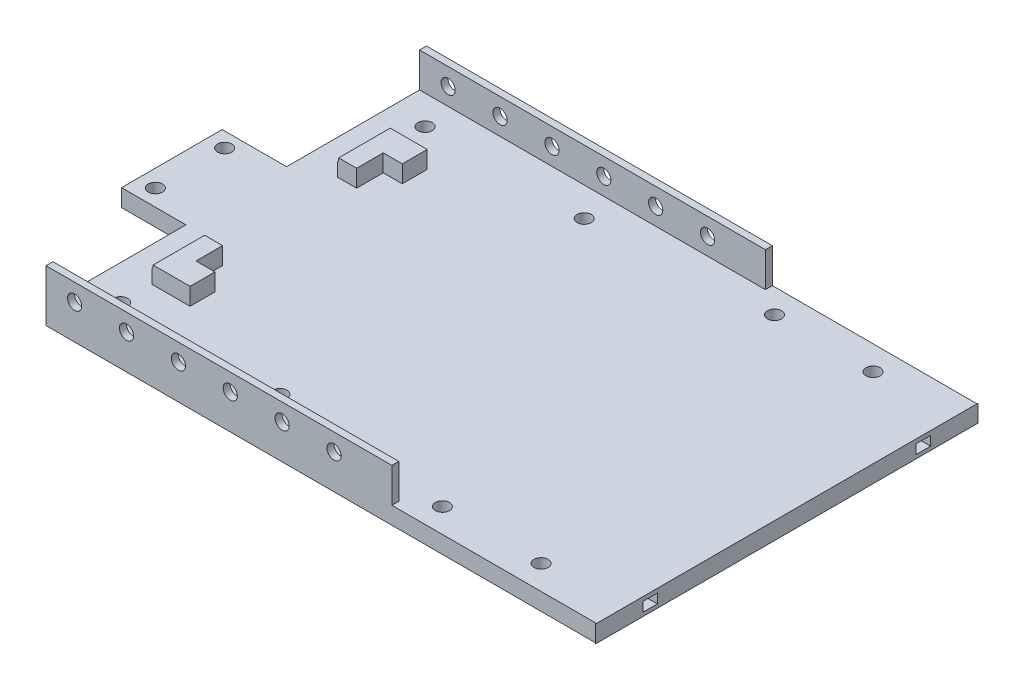
from build123d import *

# Parameters (mm, degrees)
SKETCH1_W           = 67
SKETCH1_H           = 155
SKETCH1_W_2         = 160
SKETCH1_H_2         = 110
SKETCH1_W_3         = 18.62
SKETCH1_H_3         = 29.1
BOSS_EXTRUDE1_DEPTH = 5
SKETCH4_W           = 100
SKETCH4_H           = 2
BOSS_EXTRUDE2_DEPTH = 10
SKETCH9_W           = 0.845761127
SKETCH9_H           = 22.5
BOSS_EXTRUDE4_DEPTH = 5
BOSS_EXTRUDE3_DEPTH = 5
SKETCH7_R           = 2.05
CUT_EXTRUDE2_DEPTH  = 10
SKETCH6_R           = 2.05
CUT_EXTRUDE1_DEPTH  = 227.055622359
SKETCH10_R          = 2.05
CUT_EXTRUDE4_DEPTH  = 10
FILLET1_R           = 0.3
SKETCH16_R          = 2.05
CUT_EXTRUDE5_DEPTH  = 251.551680098
SKETCH18_W          = 4
SKETCH18_H          = 2.5
BOSS_EXTRUDE7_DEPTH = 7
SKETCH20_W          = 4.2
SKETCH20_H          = 2.7
SKETCH20_W_2        = 4
SKETCH20_H_2        = 2.5
CUT_EXTRUDE7_DEPTH  = 8
SKETCH21_W          = 4
SKETCH21_H          = 2.5
CUT_EXTRUDE8_DEPTH  = 1


with BuildPart() as part:
    # Sketch1 → Boss-Extrude1 (new body)
    with BuildSketch(Plane(origin=(0, 0, 0), x_dir=(1, 0, 0), z_dir=(0, 1, 0))):
        Rectangle(SKETCH1_W, SKETCH1_H)
        with Locations((-113.5, 0)):
            Rectangle(SKETCH1_W_2, SKETCH1_H_2)
        with Locations((-202.81, 0)):
            Rectangle(SKETCH1_W_3, SKETCH1_H_3)
    extrude(amount=BOSS_EXTRUDE1_DEPTH)

    # Sketch4 → Boss-Extrude2 (add)
    with BuildSketch(Plane(origin=(0, 5, 0), x_dir=(1, 0, 0), z_dir=(0, 1, 0))):
        with Locations((-143.5, -54)):
            Rectangle(SKETCH4_W, SKETCH4_H)
        with Locations((-143.5, 54)):
            Rectangle(SKETCH4_W, SKETCH4_H)
    extrude(amount=BOSS_EXTRUDE2_DEPTH)

    # Sketch9 → Boss-Extrude4 (add)
    with BuildSketch(Plane(origin=(0, 5, 0), x_dir=(1, 0, 0), z_dir=(0, 1, 0))):
        with Locations((-33.922880564, -66.25)):
            Rectangle(SKETCH9_W, SKETCH9_H)
        with Locations((-33.922880564, 66.25)):
            Rectangle(SKETCH9_W, SKETCH9_H)
    extrude(amount=-BOSS_EXTRUDE4_DEPTH)

    # Sketch5 → Boss-Extrude3 (add)
    with BuildSketch(Plane(origin=(0, 5, 0), x_dir=(1, 0, 0), z_dir=(0, 1, 0))):
        Polygon((-178, 27), (-172.5, 27), (-172.5, 34.2), (-183.5, 34.2), (-183.5, 19.3), (-178, 19.3), align=None)
        Polygon((-178, -27.15), (-172.5, -27.15), (-172.5, -34.35), (-183.5, -34.35), (-183.5, -19.45), (-178, -19.45), align=None)
        Polygon((-13.85, 27), (-13.85, 19.3), (-8.35, 19.3), (-8.35, 34.2), (-19.35, 34.2), (-19.35, 27), align=None)
        Polygon((-19.35, -27.15), (-19.35, -34.35), (-8.35, -34.35), (-8.35, -19.45), (-13.85, -19.45), (-13.85, -27.15), align=None)
    extrude(amount=BOSS_EXTRUDE3_DEPTH)

    # Sketch7 → Cut-Extrude2 (cut)
    with BuildSketch(Plane(origin=(0, 5, 0), x_dir=(1, 0, 0), z_dir=(0, 1, 0))):
        with Locations(Location((-207.12, 10.268043156, 0), (0, 0, 270))):
            Circle(SKETCH7_R)
        with Locations(Location((-207.12, -9.741956844, 0), (0, 0, 270))):
            Circle(SKETCH7_R)
    extrude(amount=-CUT_EXTRUDE2_DEPTH, mode=Mode.SUBTRACT)

    # Sketch6 → Cut-Extrude1 (cut, through all)
    with BuildSketch(Plane(origin=(0, 5, 0), x_dir=(1, 0, 0), z_dir=(0, 1, 0))):
        with Locations(Location((-85.880982052, -48, 0), (0, 0, 270))):
            Circle(SKETCH6_R)
        with Locations(Location((-57.380982052, -48, 0), (0, 0, 270))):
            Circle(SKETCH6_R)
        with Locations(Location((-57.380982052, 48, 0), (0, 0, 90))):
            Circle(SKETCH6_R)
        with Locations(Location((-85.880982052, 48, 0), (0, 0, 90))):
            Circle(SKETCH6_R)
    extrude(amount=-CUT_EXTRUDE1_DEPTH, mode=Mode.SUBTRACT)

    # Sketch10 → Cut-Extrude4 (cut)
    with BuildSketch(Plane(origin=(0, 5, 0), x_dir=(1, 0, 0), z_dir=(0, 1, 0))):
        with Locations(Location((-183.5, 44.599757133, 0), (0, 0, 270))):
            Circle(SKETCH10_R)
        with Locations(Location((-137.5, 44.599757133, 0), (0, 0, 270))):
            Circle(SKETCH10_R)
        with Locations(Location((-183.5, -43.400242867, 0), (0, 0, 270))):
            Circle(SKETCH10_R)
        with Locations(Location((-137.5, -43.400242867, 0), (0, 0, 270))):
            Circle(SKETCH10_R)
    extrude(amount=-CUT_EXTRUDE4_DEPTH, mode=Mode.SUBTRACT)

    # Fillet1
    fillet1_edges = [part.edges().sort_by_distance(p)[0] for p in [
        (-34.345761127, 2.5, 55),
        (-34.345761127, 2.5, -55),
    ]]
    fillet(fillet1_edges, radius=FILLET1_R)

    # Sketch16 → Cut-Extrude5 (cut, through all)
    with BuildSketch(Plane.XY.offset(55)):
        with Locations((-140.228178999, 10)):
            Circle(SKETCH16_R)
        with Locations((-125.228178999, 10)):
            Circle(SKETCH16_R)
        with Locations((-110.228178999, 10)):
            Circle(SKETCH16_R)
        with Locations((-155.228178999, 10)):
            Circle(SKETCH16_R)
        with Locations((-170.228178999, 10)):
            Circle(SKETCH16_R)
        with Locations((-185.228178999, 10)):
            Circle(SKETCH16_R)
    extrude(amount=-CUT_EXTRUDE5_DEPTH, mode=Mode.SUBTRACT)


with BuildPart() as body_2:
    # Split1: the piece on the far side of the plane
    add(part.part)
    split(bisect_by=Plane(origin=(-34.345761127, 0, 0), x_dir=(0, 0, 1), z_dir=(1, 0, 0)), keep=Keep.BOTTOM)


with BuildPart() as part_1:
    add(part.part)

    # Split1
    split(bisect_by=Plane(origin=(-34.345761127, 0, 0), x_dir=(0, 0, 1), z_dir=(1, 0, 0)), keep=Keep.TOP)

    # Sketch18 → Boss-Extrude7 (add)
    with BuildSketch(Plane.ZY.offset(34.345761127)):
        with Locations((-39.5, 2.443337799)):
            Rectangle(SKETCH18_W, SKETCH18_H)
        with Locations((39.5, 2.443337799)):
            Rectangle(SKETCH18_W, SKETCH18_H)
    extrude(amount=BOSS_EXTRUDE7_DEPTH)


with BuildPart() as body_2_1:
    add(body_2.part)

    # Combine1: cut part
    add(part_1.part, mode=Mode.SUBTRACT)

    # Sketch20 → Cut-Extrude7 (cut)
    # profile 1 of 2: a face of its own
    with BuildSketch(Plane(origin=(-34.345761127, 0, 0), x_dir=(0, 0, -1), z_dir=(1, 0, 0))):
        with Locations((-39.5, 2.443337799)):
            Rectangle(SKETCH20_W, SKETCH20_H)
        with Locations((-39.5, 2.443337799)):
            Rectangle(SKETCH20_W_2, SKETCH20_H_2, mode=Mode.SUBTRACT)
    # profile 2 of 2: a face of its own
    with BuildSketch(Plane(origin=(-34.345761127, 0, 0), x_dir=(0, 0, -1), z_dir=(1, 0, 0))):
        with Locations((39.5, 2.443337799)):
            Rectangle(SKETCH20_W, SKETCH20_H)
        with Locations((39.5, 2.443337799)):
            Rectangle(SKETCH20_W_2, SKETCH20_H_2, mode=Mode.SUBTRACT)
    extrude(amount=-CUT_EXTRUDE7_DEPTH, mode=Mode.SUBTRACT)

    # Sketch21 → Cut-Extrude8 (cut)
    with BuildSketch(Plane(origin=(-41.345761127, 0, 0), x_dir=(0, 0, -1), z_dir=(1, 0, 0))):
        with Locations((39.5, 2.443337799)):
            Rectangle(SKETCH21_W, SKETCH21_H)
        with Locations((-39.5, 2.443337799)):
            Rectangle(SKETCH21_W, SKETCH21_H)
    extrude(amount=-CUT_EXTRUDE8_DEPTH, mode=Mode.SUBTRACT)


solid = body_2_1.part
